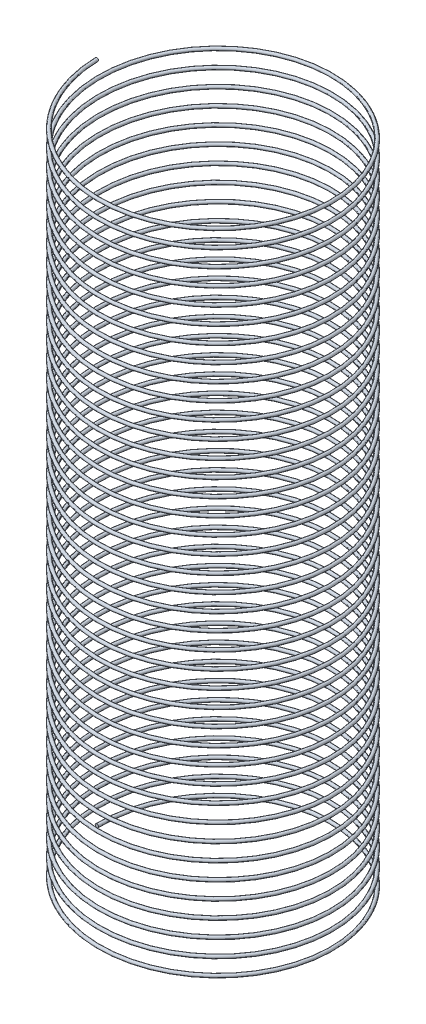
from build123d import *

# Parameters (mm, degrees)
SWEEP_1_PITCH       = 5
SWEEP_1_HEIGHT      = 200
SWEEP_1_RADIUS      = 35
SWEEP_1_START_ANGLE = -90
SWEEP_1_PROFILE_R   = 0.5


with BuildPart() as part:
    # 扫描1: sweep along a helix
    with BuildLine() as sweep_1_path:
        add(Helix(SWEEP_1_PITCH, SWEEP_1_HEIGHT, SWEEP_1_RADIUS, center=(0, 0, 0), direction=(0, 1, 0), lefthand=True, mode=Mode.PRIVATE).rotate(Axis((0, 0, 0), (0, 1, 0)), SWEEP_1_START_ANGLE))
    # 扫描1 profile (on start of the path) → 扫描1 (sweep)
    with BuildSketch(Plane(origin=(-35, 0, 0), x_dir=(0, -0.9997416277615768, -0.02273054598184592), z_dir=(1.498652466634216e-13, 0.02273054598184592, -0.9997416277615768))):
        Circle(SWEEP_1_PROFILE_R)
    sweep(path=sweep_1_path.line, is_frenet=True)


solid = part.part
